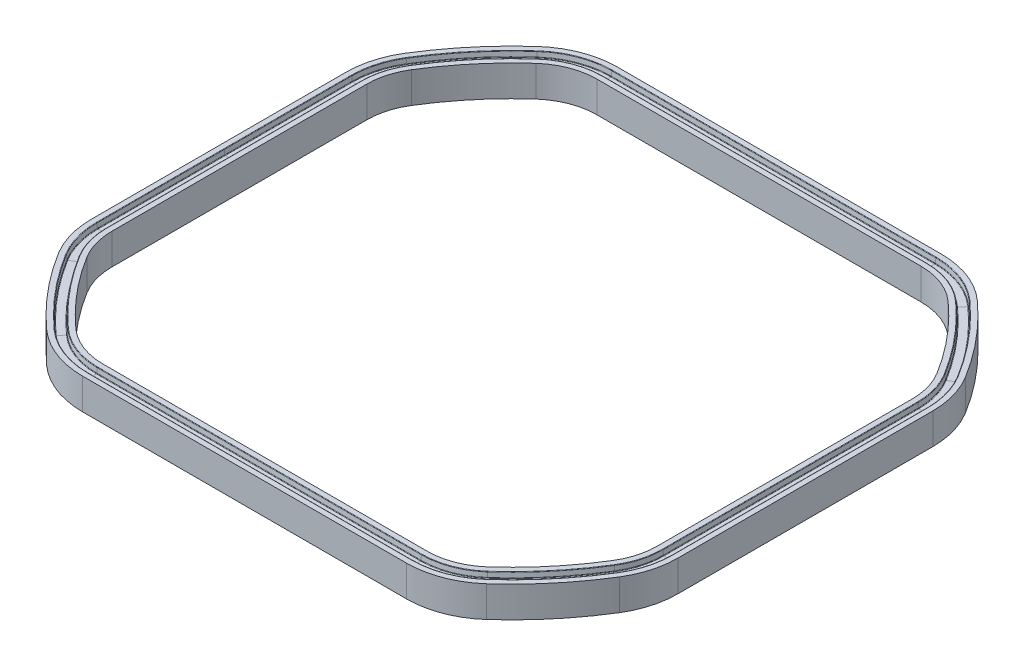
from build123d import *

# Parameters (mm, degrees)
PROFILE_DEPTH = 1.5


with BuildPart() as part:
    # ProfileS → Profile (new, symmetric)
    with BuildSketch(Plane(origin=(0, 0, 0), x_dir=(1, 0, 0), z_dir=(0, 1, 0))):
        with BuildLine():
            Line((-28.4, 12.338962679), (-28.4, -12.338962679))
            ThreePointArc((-28.4, -12.338962679), (-28.081183819, -14.631225335), (-27.14893617, -16.749485509))
            ThreePointArc((-27.14893617, -16.749485509), (-24.471831346, -20.463124653), (-21.290721268, -23.755319149))
            ThreePointArc((-21.290721268, -23.755319149), (-18.685663466, -25.345529965), (-15.684387141, -25.9))
            Line((-15.684387141, -25.9), (15.684387141, -25.9))
            ThreePointArc((15.684387141, -25.9), (18.685663466, -25.345529965), (21.290721268, -23.755319149))
            ThreePointArc((21.290721268, -23.755319149), (24.471831346, -20.463124653), (27.14893617, -16.749485509))
            ThreePointArc((27.14893617, -16.749485509), (28.081183819, -14.631225335), (28.4, -12.338962679))
            Line((28.4, -12.338962679), (28.4, 12.338962679))
            ThreePointArc((28.4, 12.338962679), (28.081183819, 14.631225335), (27.14893617, 16.749485509))
            ThreePointArc((27.14893617, 16.749485509), (24.471831346, 20.463124653), (21.290721268, 23.755319149))
            ThreePointArc((21.290721268, 23.755319149), (18.685663466, 25.345529965), (15.684387141, 25.9))
            Line((15.684387141, 25.9), (-15.684387141, 25.9))
            ThreePointArc((-15.684387141, 25.9), (-18.685663466, 25.345529965), (-21.290721268, 23.755319149))
            ThreePointArc((-21.290721268, 23.755319149), (-24.471831346, 20.463124653), (-27.14893617, 16.749485509))
            ThreePointArc((-27.14893617, 16.749485509), (-28.081183819, 14.631225335), (-28.4, 12.338962679))
        make_face()
        with BuildLine():
            Line((-26.4, 12.338962679), (-26.4, -12.338962679))
            ThreePointArc((-26.4, -12.338962679), (-26.157092433, -14.085448513), (-25.446808511, -15.699361026))
            ThreePointArc((-25.446808511, -15.699361026), (-22.937547249, -19.180170129), (-19.95587981, -22.265957447))
            ThreePointArc((-19.95587981, -22.265957447), (-17.971073865, -23.47754664), (-15.684387141, -23.9))
            Line((-15.684387141, -23.9), (15.684387141, -23.9))
            ThreePointArc((15.684387141, -23.9), (17.971073865, -23.47754664), (19.95587981, -22.265957447))
            ThreePointArc((19.95587981, -22.265957447), (22.937547249, -19.180170129), (25.446808511, -15.699361026))
            ThreePointArc((25.446808511, -15.699361026), (26.157092433, -14.085448513), (26.4, -12.338962679))
            Line((26.4, -12.338962679), (26.4, 12.338962679))
            ThreePointArc((26.4, 12.338962679), (26.157092433, 14.085448513), (25.446808511, 15.699361026))
            ThreePointArc((25.446808511, 15.699361026), (22.937547249, 19.180170129), (19.95587981, 22.265957447))
            ThreePointArc((19.95587981, 22.265957447), (17.971073865, 23.47754664), (15.684387141, 23.9))
            Line((15.684387141, 23.9), (-15.684387141, 23.9))
            ThreePointArc((-15.684387141, 23.9), (-17.971073865, 23.47754664), (-19.95587981, 22.265957447))
            ThreePointArc((-19.95587981, 22.265957447), (-22.937547249, 19.180170129), (-25.446808511, 15.699361026))
            ThreePointArc((-25.446808511, 15.699361026), (-26.157092433, 14.085448513), (-26.4, 12.338962679))
        make_face(mode=Mode.SUBTRACT)
    extrude(amount=PROFILE_DEPTH, both=True)

    # GrooveProfile: sweep along a path in ProfileS<2>
    with BuildLine(Plane(origin=(0, 0, 0), x_dir=(1, 0, 0), z_dir=(0, 1, 0))) as grooveprofile_path:
        Line((-27.4, 12.338962679), (-27.4, -12.338962679))
        ThreePointArc((-27.4, -12.338962679), (-27.119138126, -14.358336924), (-26.29787234, -16.224423268))
        ThreePointArc((-26.29787234, -16.224423268), (-23.704689298, -19.821647391), (-20.623300539, -23.010638298))
        ThreePointArc((-20.623300539, -23.010638298), (-18.328368665, -24.411538302), (-15.684387141, -24.9))
        Line((-15.684387141, -24.9), (15.684387141, -24.9))
        ThreePointArc((15.684387141, -24.9), (18.328368665, -24.411538302), (20.623300539, -23.010638298))
        ThreePointArc((20.623300539, -23.010638298), (23.704689298, -19.821647391), (26.29787234, -16.224423268))
        ThreePointArc((26.29787234, -16.224423268), (27.119138126, -14.358336924), (27.4, -12.338962679))
        Line((27.4, -12.338962679), (27.4, 12.338962679))
        ThreePointArc((27.4, 12.338962679), (27.119138126, 14.358336924), (26.29787234, 16.224423268))
        ThreePointArc((26.29787234, 16.224423268), (23.704689298, 19.821647391), (20.623300539, 23.010638298))
        ThreePointArc((20.623300539, 23.010638298), (18.328368665, 24.411538302), (15.684387141, 24.9))
        Line((15.684387141, 24.9), (-15.684387141, 24.9))
        ThreePointArc((-15.684387141, 24.9), (-18.328368665, 24.411538302), (-20.623300539, 23.010638298))
        ThreePointArc((-20.623300539, 23.010638298), (-23.704689298, 19.821647391), (-26.29787234, 16.224423268))
        ThreePointArc((-26.29787234, 16.224423268), (-27.119138126, 14.358336924), (-27.4, 12.338962679))
    # GrooveProfileS → GrooveProfile (sweep, cut)
    with BuildSketch(Plane.XY):
        with BuildLine():
            Line((-27.9, 1.5), (-26.9, 1.5))
            ThreePointArc((-26.9, 1.5), (-26.933141479, 1.487438515), (-26.94963071, 1.456065696))
            Line((-26.94963071, 1.456065696), (-27, 1.043934304))
            ThreePointArc((-27, 1.043934304), (-27.016489231, 1.012561485), (-27.04963071, 1))
            Line((-27.04963071, 1), (-27.75036929, 1))
            ThreePointArc((-27.75036929, 1), (-27.783510769, 1.012561485), (-27.8, 1.043934304))
            Line((-27.8, 1.043934304), (-27.85036929, 1.456065696))
            ThreePointArc((-27.85036929, 1.456065696), (-27.866858521, 1.487438515), (-27.9, 1.5))
        make_face()
    grooveprofile = sweep(path=grooveprofile_path.line, mode=Mode.SUBTRACT)

    # Mirror1: GrooveProfile across plane
    add(grooveprofile.mirror(Plane.ZX), mode=Mode.SUBTRACT)


solid = part.part
